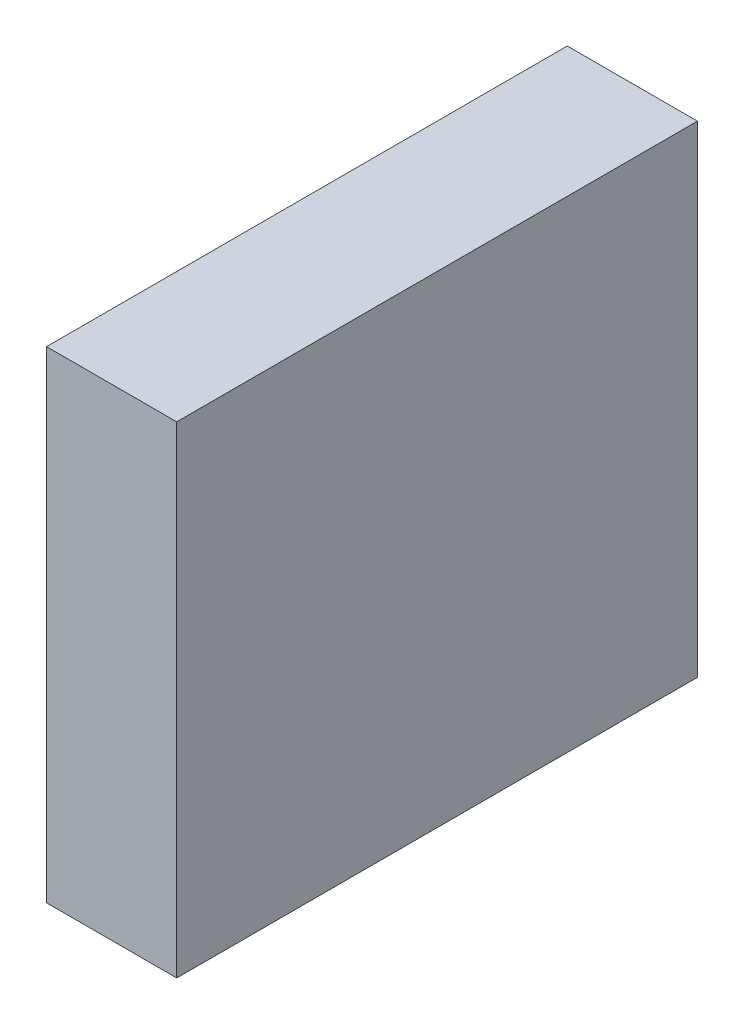
from build123d import *

# Parameters (mm, degrees)
SKETCH1_W           = 40
SKETCH1_H           = 37
BOSS_EXTRUDE1_DEPTH = 10


with BuildPart() as part:
    # Sketch1 → Boss-Extrude1 (new body)
    with BuildSketch(Plane(origin=(0, 0, 0), x_dir=(0, 0, -1), z_dir=(1, 0, 0))):
        with Locations((20, 18.5)):
            Rectangle(SKETCH1_W, SKETCH1_H)
    extrude(amount=-BOSS_EXTRUDE1_DEPTH)


solid = part.part
